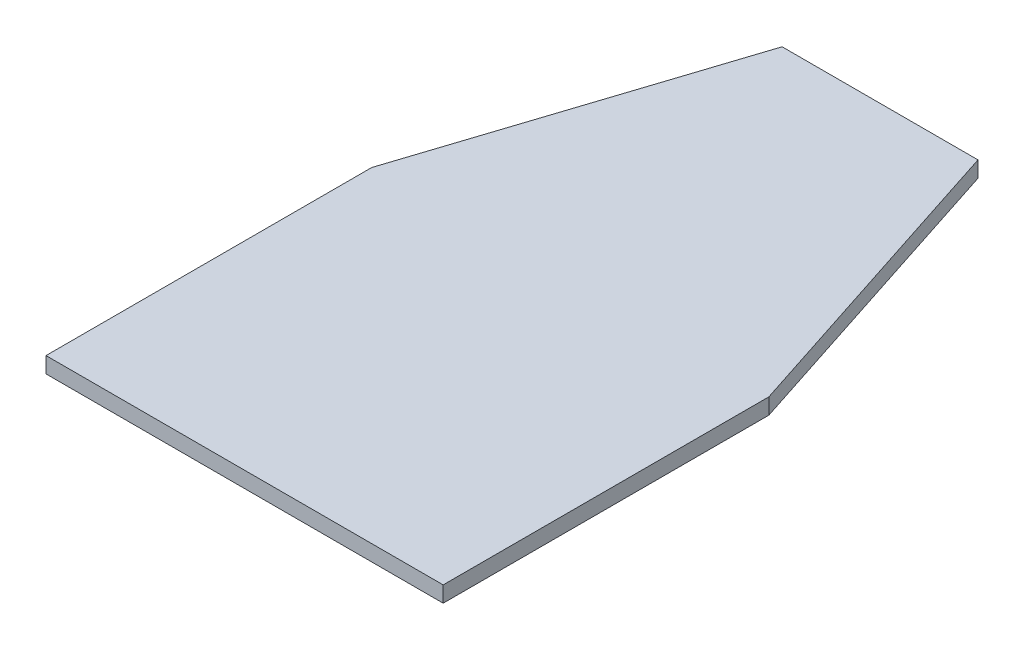
from build123d import *

# Parameters (mm, degrees)
RESSALTO_EXTRUS_O1_DEPTH = 10


with BuildPart() as part:
    # Esboço2 → Ressalto-extrusão1 (new body)
    with BuildSketch(Plane(origin=(0, 0, 0), x_dir=(1, 0, 0), z_dir=(0, 1, 0))):
        Polygon((-125, 0), (125, 0), (125, 205.017126187), (61.64622387, 400), (-61.64622387, 400), (-125, 205.017126187), align=None)
    extrude(amount=RESSALTO_EXTRUS_O1_DEPTH)


solid = part.part
